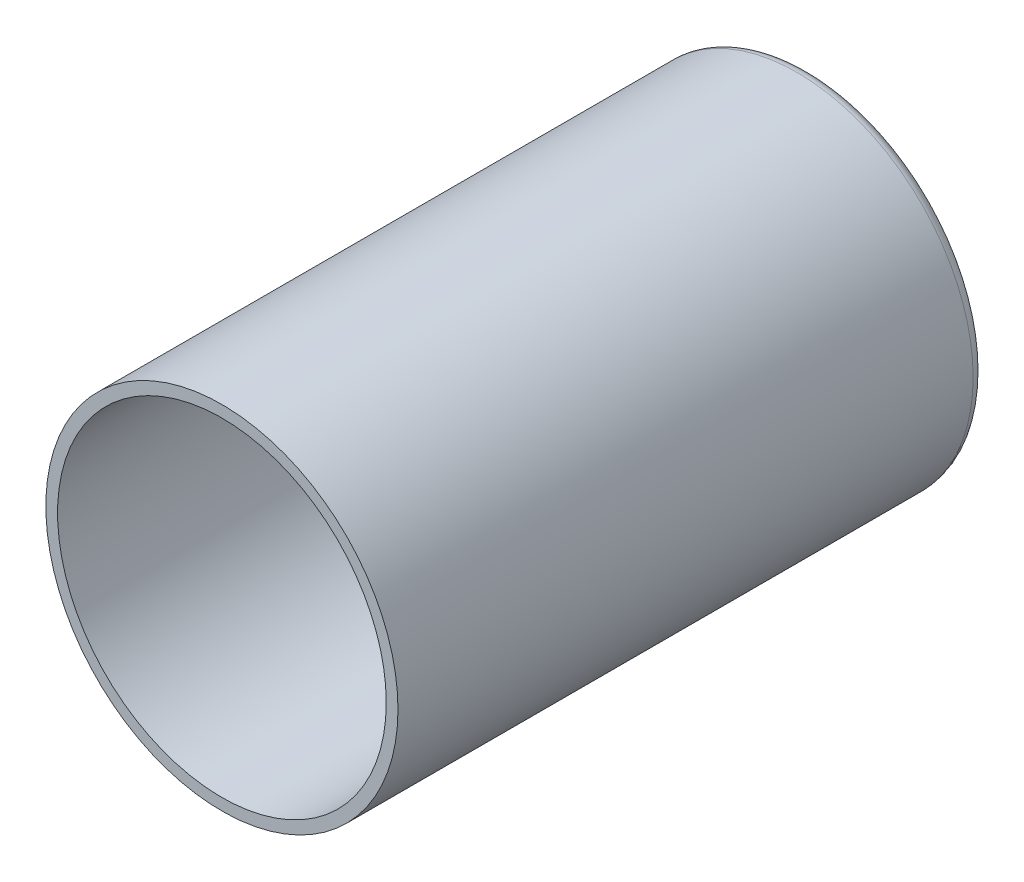
from build123d import *

# Parameters (mm, degrees)
SKETCH1_R           = 30
BOSS_EXTRUDE1_DEPTH = 100
SHELL1_T            = -2
FILLET1_R           = 2
SKETCH2_R           = 10
BOSS_EXTRUDE2_DEPTH = 5
SKETCH3_R           = 2.5
CUT_EXTRUDE1_DEPTH  = 114.247516529


with BuildPart() as part:
    # Sketch1 → Boss-Extrude1 (new body)
    with BuildSketch(Plane.XY):
        Circle(SKETCH1_R)
    extrude(amount=BOSS_EXTRUDE1_DEPTH)

    # Shell1
    shell1_openings = [part.faces().sort_by_distance(p)[0] for p in [
        (0, 0, 100),
    ]]
    offset(amount=SHELL1_T, openings=shell1_openings, kind=Kind.INTERSECTION)

    # Fillet1
    fillet1_edges = [part.edges().sort_by_distance(p)[0] for p in [
        (-30, 0, 0),
    ]]
    fillet(fillet1_edges, radius=FILLET1_R)

    # Sketch2 → Boss-Extrude2 (add)
    with BuildSketch(Plane(origin=(0, 0, 0), x_dir=(-1, 0, 0), z_dir=(0, 0, -1))):
        with Locations(Location((0, 0, 0), (0, 0, 180))):
            Circle(SKETCH2_R)
    extrude(amount=BOSS_EXTRUDE2_DEPTH)

    # Sketch3 → Cut-Extrude1 (cut, through all)
    with BuildSketch(Plane(origin=(0, 0, -5), x_dir=(-1, 0, 0), z_dir=(0, 0, -1))):
        Circle(SKETCH3_R)
    extrude(amount=-CUT_EXTRUDE1_DEPTH, mode=Mode.SUBTRACT)


solid = part.part
